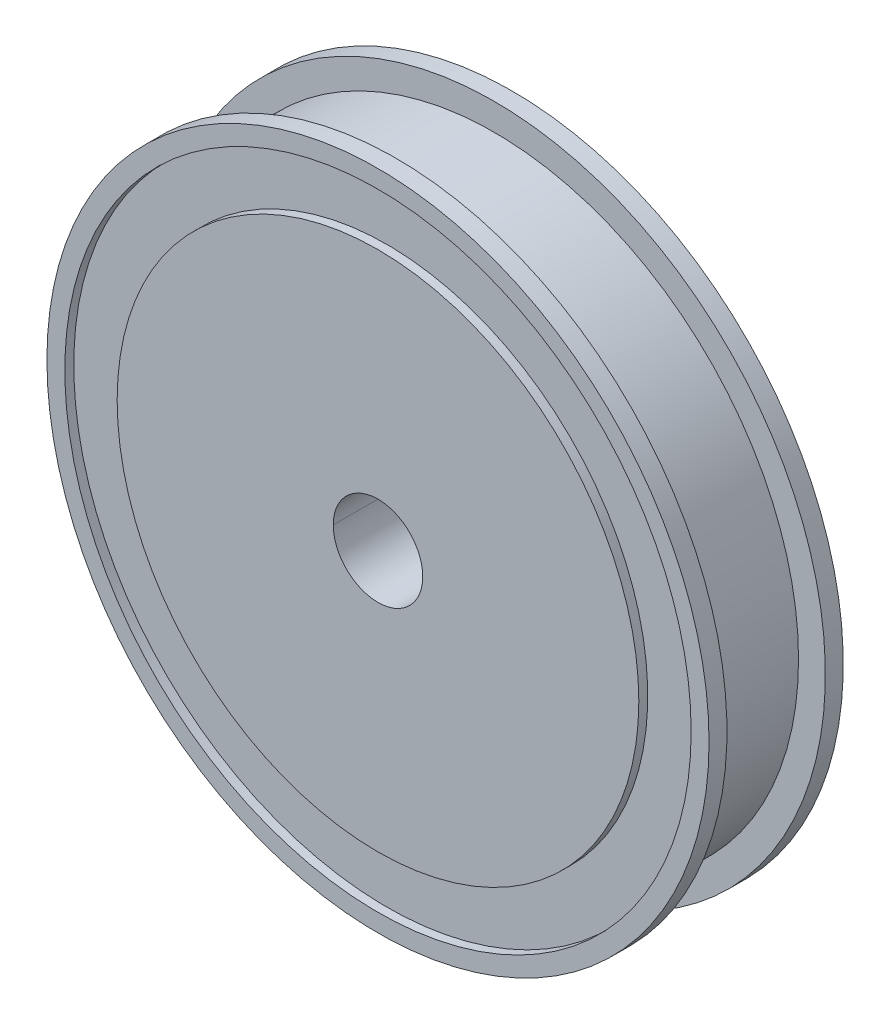
from build123d import *

# Parameters (mm, degrees)
SKETCH_1_R          = 37
SKETCH_1_R_2        = 35
EXTRUDE_1_DEPTH     = 1
SKETCH_1_R_3        = 29.15
EXTRUDE_1_2_DEPTH   = 1
EXTRUDE_START       = 1
SKETCH_2_R          = 37
EXTRUDE_2_DEPTH     = 1
SKETCH_3_R          = 34
EXTRUDE_3_DEPTH     = 11
SKETCH_5_R          = 37
EXTRUDE_4_DEPTH     = 1
SKETCH_4_R          = 37
SKETCH_4_R_2        = 35
SKETCH_4_R_3        = 29.15
EXTRUDE_5_DEPTH     = 1
SKETCH_6_R          = 5
CUT_EXTRUDE_1_DEPTH = 55.433445601


with BuildPart() as part:
    # 스케치1 → 보스-돌출1 (new body)
    with BuildSketch(Plane.XY):
        Circle(SKETCH_1_R)
        Circle(SKETCH_1_R_2, mode=Mode.SUBTRACT)
    extrude(amount=EXTRUDE_1_DEPTH)



with BuildPart() as body_2:
    # 스케치1 → Extrude 1 2 (new body)
    with BuildSketch(Plane.XY):
        Circle(SKETCH_1_R_3)
    extrude(amount=EXTRUDE_1_2_DEPTH)


with BuildPart() as part_1:
    add(part.part)

    add(body_2.part)  # 보스-돌출2 merges body 2
    # 스케치2 → 보스-돌출2 (add)
    with BuildSketch(Plane(origin=(0, 0, 0), x_dir=(-1, 0, 0), z_dir=(0, 0, -1)).offset(EXTRUDE_START)):
        Circle(SKETCH_2_R)
    extrude(amount=-EXTRUDE_2_DEPTH)

    # 스케치3 → 보스-돌출3 (add)
    with BuildSketch(Plane(origin=(0, 0, -1), x_dir=(-1, 0, 0), z_dir=(0, 0, -1))):
        Circle(SKETCH_3_R)
    extrude(amount=EXTRUDE_3_DEPTH)

    # 스케치5 → 보스-돌출4 (add)
    with BuildSketch(Plane(origin=(0, 0, -12), x_dir=(-1, 0, 0), z_dir=(0, 0, -1)).offset(EXTRUDE_START)):
        Circle(SKETCH_5_R)
    extrude(amount=-EXTRUDE_4_DEPTH)

    # 스케치4 → 보스-돌출5 (add)
    # profile 1 of 2: a face of its own
    with BuildSketch(Plane(origin=(0, 0, -13), x_dir=(-1, 0, 0), z_dir=(0, 0, -1)).offset(EXTRUDE_START)):
        Circle(SKETCH_4_R)
        with Locations(Location((0, 0, 0), (0, 0, 180))):
            Circle(SKETCH_4_R_2, mode=Mode.SUBTRACT)
    # profile 2 of 2: a face of its own
    with BuildSketch(Plane(origin=(0, 0, -13), x_dir=(-1, 0, 0), z_dir=(0, 0, -1)).offset(EXTRUDE_START)):
        Circle(SKETCH_4_R_3)
    extrude(amount=-EXTRUDE_5_DEPTH)

    # 스케치6 → 컷-돌출1 (cut, through all)
    with BuildSketch(Plane(origin=(0, 0, -14), x_dir=(-1, 0, 0), z_dir=(0, 0, -1))):
        Circle(SKETCH_6_R)
    extrude(amount=-CUT_EXTRUDE_1_DEPTH, mode=Mode.SUBTRACT)


solid = part_1.part
